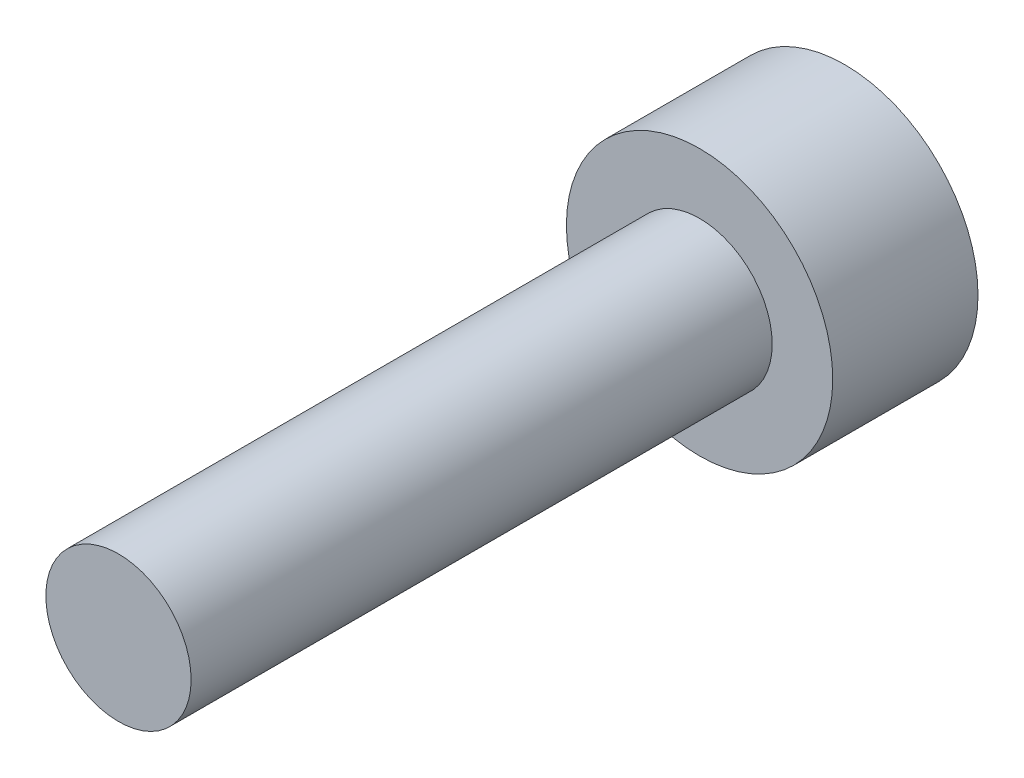
from build123d import *

# Parameters (mm, degrees)
SKETCH_1_R          = 2.75
EXTRUDE_1_DEPTH     = 3
SKETCH_2_R          = 1.5
EXTRUDE_2_DEPTH     = 12
CUT_EXTRUDE_1_DEPTH = 2


with BuildPart() as part:
    # ｽｹｯﾁ1 → ﾎﾞｽ - 押し出し1 (new body)
    with BuildSketch(Plane.XY):
        Circle(SKETCH_1_R)
    extrude(amount=EXTRUDE_1_DEPTH)

    # ｽｹｯﾁ2 → ﾎﾞｽ - 押し出し2 (add)
    with BuildSketch(Plane.XY.offset(3)):
        Circle(SKETCH_2_R)
    extrude(amount=EXTRUDE_2_DEPTH)

    # ｽｹｯﾁ3 → ｶｯﾄ - 押し出し1 (cut)
    with BuildSketch(Plane(origin=(0, 0, 0), x_dir=(-1, 0, 0), z_dir=(0, 0, -1))):
        Polygon((1.66357981, -0.399103763), (1.177423903, 1.241150495), (-0.486155907, 1.640254258), (-1.66357981, 0.399103763), (-1.177423903, -1.241150495), (0.486155907, -1.640254258), align=None)
    extrude(amount=-CUT_EXTRUDE_1_DEPTH, mode=Mode.SUBTRACT)


solid = part.part
